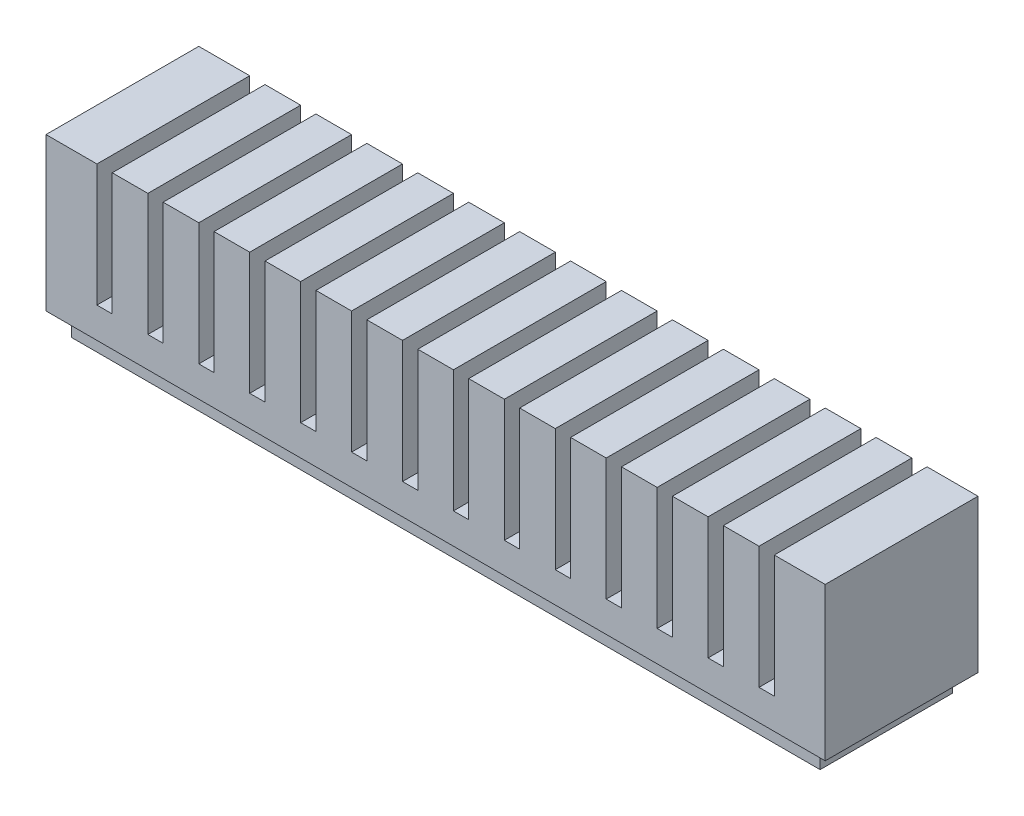
from build123d import *

# Parameters (mm, degrees)
SKETCH1_W           = 3.5
SKETCH1_H           = 15
BOSS_EXTRUDE1_DEPTH = 15
SKETCH2_W           = 1.5
SKETCH2_H           = 11
CUT_EXTRUDE1_DEPTH  = 13
SKETCH3_W           = 15
SKETCH3_H           = 3
BOSS_EXTRUDE2_DEPTH = 1.5
LPATTERN1_COUNT     = 15
LPATTERN1_PITCH     = 5
SKETCH4_W           = 15
SKETCH4_H           = 15
BOSS_EXTRUDE3_DEPTH = 1.5
SKETCH5_W           = 15
SKETCH5_H           = 12
BOSS_EXTRUDE4_DEPTH = 1.5
SKETCH7_W           = 68.5
SKETCH7_H           = 2
CUT_EXTRUDE2_DEPTH  = 2
SKETCH8_W           = 73.5
SKETCH8_H           = 13
SKETCH8_W_2         = 71.5
SKETCH8_H_2         = 11
BOSS_EXTRUDE5_DEPTH = 2
SKETCH9_W           = 1.5
SKETCH9_H           = 2.5
BOSS_EXTRUDE6_DEPTH = 2
LPATTERN2_COUNT     = 14
LPATTERN2_PITCH     = 5


with BuildPart() as part:
    # Sketch1 → Boss-Extrude1 (new body)
    with BuildSketch(Plane(origin=(0, 0, 0), x_dir=(1, 0, 0), z_dir=(0, 1, 0))):
        with Locations((1.75, 7.5)):
            Rectangle(SKETCH1_W, SKETCH1_H)
    extrude(amount=BOSS_EXTRUDE1_DEPTH)

    # Sketch2 → Cut-Extrude1 (cut)
    with BuildSketch(Plane.XZ):
        with Locations((1.75, -7.5)):
            Rectangle(SKETCH2_W, SKETCH2_H)
    extrude(amount=-CUT_EXTRUDE1_DEPTH, mode=Mode.SUBTRACT)

    # Sketch3 → Boss-Extrude2 (add)
    with BuildSketch(Plane.ZY):
        with Locations((-7.5, 1.5)):
            Rectangle(SKETCH3_W, SKETCH3_H)
    extrude(amount=BOSS_EXTRUDE2_DEPTH)


with BuildPart() as lpattern1_1:
    # LPattern1: pattern copy
    add(part.part.moved(Location(Vector(1, 0, 0) * (1 * LPATTERN1_PITCH))))


with BuildPart() as lpattern1_2:
    # LPattern1: pattern copy
    add(part.part.moved(Location(Vector(1, 0, 0) * (2 * LPATTERN1_PITCH))))


with BuildPart() as lpattern1_3:
    # LPattern1: pattern copy
    add(part.part.moved(Location(Vector(1, 0, 0) * (3 * LPATTERN1_PITCH))))


with BuildPart() as lpattern1_4:
    # LPattern1: pattern copy
    add(part.part.moved(Location(Vector(1, 0, 0) * (4 * LPATTERN1_PITCH))))


with BuildPart() as lpattern1_5:
    # LPattern1: pattern copy
    add(part.part.moved(Location(Vector(1, 0, 0) * (5 * LPATTERN1_PITCH))))


with BuildPart() as lpattern1_6:
    # LPattern1: pattern copy
    add(part.part.moved(Location(Vector(1, 0, 0) * (6 * LPATTERN1_PITCH))))


with BuildPart() as lpattern1_7:
    # LPattern1: pattern copy
    add(part.part.moved(Location(Vector(1, 0, 0) * (7 * LPATTERN1_PITCH))))


with BuildPart() as lpattern1_8:
    # LPattern1: pattern copy
    add(part.part.moved(Location(Vector(1, 0, 0) * (8 * LPATTERN1_PITCH))))


with BuildPart() as lpattern1_9:
    # LPattern1: pattern copy
    add(part.part.moved(Location(Vector(1, 0, 0) * (9 * LPATTERN1_PITCH))))


with BuildPart() as lpattern1_10:
    # LPattern1: pattern copy
    add(part.part.moved(Location(Vector(1, 0, 0) * (10 * LPATTERN1_PITCH))))


with BuildPart() as lpattern1_11:
    # LPattern1: pattern copy
    add(part.part.moved(Location(Vector(1, 0, 0) * (11 * LPATTERN1_PITCH))))


with BuildPart() as lpattern1_12:
    # LPattern1: pattern copy
    add(part.part.moved(Location(Vector(1, 0, 0) * (12 * LPATTERN1_PITCH))))


with BuildPart() as lpattern1_13:
    # LPattern1: pattern copy
    add(part.part.moved(Location(Vector(1, 0, 0) * (13 * LPATTERN1_PITCH))))


with BuildPart() as lpattern1_14:
    # LPattern1: pattern copy
    add(part.part.moved(Location(Vector(1, 0, 0) * (14 * LPATTERN1_PITCH))))


with BuildPart() as lpattern1_1_1:
    add(lpattern1_1.part)

    # Combine1: union LPattern1_2, LPattern1_3, LPattern1_4, LPattern1_5, LPattern1_6, LPattern1_7, LPattern1_8, LPattern1_9, LPattern1_10, LPattern1_11, LPattern1_12, LPattern1_13, LPattern1_14, part
    add(lpattern1_2.part)
    add(lpattern1_3.part)
    add(lpattern1_4.part)
    add(lpattern1_5.part)
    add(lpattern1_6.part)
    add(lpattern1_7.part)
    add(lpattern1_8.part)
    add(lpattern1_9.part)
    add(lpattern1_10.part)
    add(lpattern1_11.part)
    add(lpattern1_12.part)
    add(lpattern1_13.part)
    add(lpattern1_14.part)
    add(part.part)

    # Sketch4 → Boss-Extrude3 (add)
    with BuildSketch(Plane(origin=(73.5, 0, 0), x_dir=(0, 0, -1), z_dir=(1, 0, 0))):
        with Locations((7.5, 7.5)):
            Rectangle(SKETCH4_W, SKETCH4_H)
    extrude(amount=BOSS_EXTRUDE3_DEPTH)

    # Sketch5 → Boss-Extrude4 (add)
    with BuildSketch(Plane.ZY):
        with Locations((-7.5, 9)):
            Rectangle(SKETCH5_W, SKETCH5_H)
    extrude(amount=BOSS_EXTRUDE4_DEPTH)

    # Sketch7 → Cut-Extrude2 (cut)
    with BuildSketch(Plane.XZ):
        with Locations((36.75, -7.5)):
            Rectangle(SKETCH7_W, SKETCH7_H)
    extrude(amount=-CUT_EXTRUDE2_DEPTH, mode=Mode.SUBTRACT)

    # Sketch8 → Boss-Extrude5 (add)
    with BuildSketch(Plane(origin=(0, 0, 0), x_dir=(-1, 0, 0), z_dir=(0, -1, 0))):
        with Locations((-36.75, 7.5)):
            Rectangle(SKETCH8_W, SKETCH8_H)
        with Locations((-36.75, 7.5)):
            Rectangle(SKETCH8_W_2, SKETCH8_H_2, mode=Mode.SUBTRACT)
    extrude(amount=BOSS_EXTRUDE5_DEPTH)

    # Sketch9 → Boss-Extrude6 (add)
    with BuildSketch(Plane.XZ):
        with Locations((4.25, -4.25)):
            Rectangle(SKETCH9_W, SKETCH9_H)
        with Locations((4.25, -10.75)):
            Rectangle(SKETCH9_W, SKETCH9_H)
    boss_extrude6 = extrude(amount=BOSS_EXTRUDE6_DEPTH)

    # LPattern2: Boss-Extrude6 ×14
    with Locations(*[(i * LPATTERN2_PITCH, 0, 0) for i in range(1, LPATTERN2_COUNT)]):
        add(boss_extrude6)


solid = lpattern1_1_1.part
